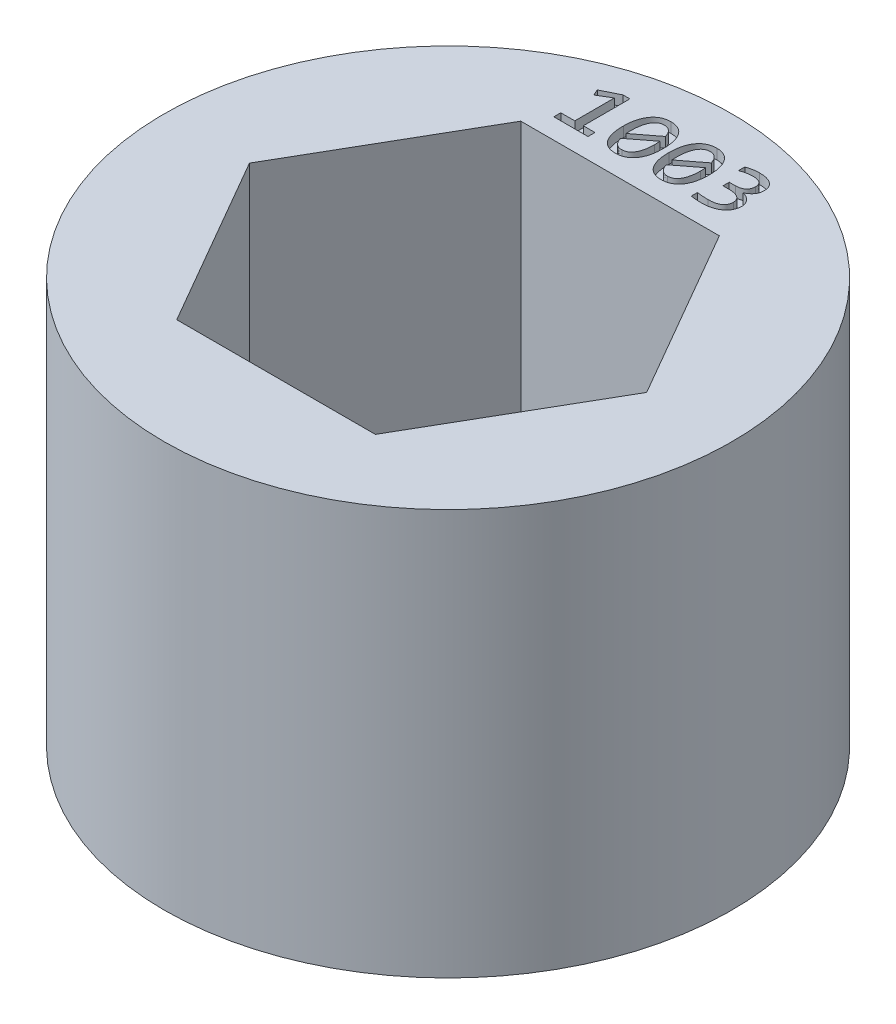
from build123d import *

# Parameters (mm, degrees)
SKETCH1_R           = 11.1125
BOSS_EXTRUDE1_DEPTH = 15.875
CUT_EXTRUDE1_DEPTH  = 0.4


with BuildPart() as part:
    # Sketch1 → Boss-Extrude1 (new body)
    with BuildSketch(Plane(origin=(0, 0, 0), x_dir=(1, 0, 0), z_dir=(0, 1, 0))):
        with Locations(Location((0, 0, 0), (0, 0, 270))):
            Circle(SKETCH1_R)
        Polygon((7.772289324, 0), (3.886144662, 6.731), (-3.886144662, 6.731), (-7.772289324, 0), (-3.886144662, -6.731), (3.886144662, -6.731), align=None, mode=Mode.SUBTRACT)
    extrude(amount=BOSS_EXTRUDE1_DEPTH)

    # Sketch2 → Cut-Extrude1 (cut)
    # profile 1 of 4: a face of its own
    with BuildSketch(Plane(origin=(0, 15.875, 0), x_dir=(1, 0, 0), z_dir=(0, 1, 0))):
        Polygon((-2.049251493, 7.52475), (-3.385828712, 7.52475), (-3.385828712, 7.798140795), (-2.839047122, 7.798140795), (-2.839047122, 9.347355299), (-3.343586037, 9.043587749), (-3.446582222, 9.286601789), (-2.776395065, 9.620746094), (-2.504902817, 9.620746094), (-2.504902817, 7.798140795), (-2.049251493, 7.798140795), align=None)
    # profile 2 of 4: a face of its own
    with BuildSketch(Plane(origin=(0, 15.875, 0), x_dir=(1, 0, 0), z_dir=(0, 1, 0))):
        with BuildLine():
            add(Edge.make_bspline(
                [(-0.165892684, 8.571798773), (-0.166325651, 8.532539667), (-0.167173732, 8.455640449), (-0.177140738, 8.343154692), (-0.192029215, 8.235790499), (-0.213292587, 8.133952321), (-0.240272581, 8.037990717), (-0.274910407, 7.94907057), (-0.314865217, 7.866804514), (-0.36154288, 7.791798506), (-0.414321619, 7.724560589), (-0.47324158, 7.664946723), (-0.538399911, 7.613533187), (-0.609814661, 7.570502981), (-0.68721939, 7.535730504), (-0.771505487, 7.511991642), (-0.861946132, 7.496719325), (-0.924455141, 7.495170599), (-0.956637587, 7.494373245)],
                knots=[0, 0, 0, 0, 1.248871528, 2.446241243, 3.590357027, 4.69618527, 5.754202854, 6.758290001, 7.728669934, 8.660396172, 9.563796911, 10.443071522, 11.321307858, 12.197637495, 13.090115231, 14.012601613, 14.976798049, 16, 16, 16, 16], degree=3))
            add(Edge.make_bspline(
                [(-0.956637587, 7.494373245), (-0.984523883, 7.495052085), (-1.039450838, 7.49638918), (-1.119857224, 7.508449964), (-1.196306294, 7.528578979), (-1.268936867, 7.555832092), (-1.33687734, 7.592268051), (-1.399769911, 7.637185139), (-1.457884215, 7.690364794), (-1.510227055, 7.752740329), (-1.557317942, 7.823677829), (-1.598168065, 7.90395186), (-1.633485499, 7.992818781), (-1.663637227, 8.090645609), (-1.686393921, 8.197912899), (-1.703489664, 8.314242635), (-1.713327632, 8.43999634), (-1.714500293, 8.526849228), (-1.715107188, 8.571798773)],
                knots=[0, 0, 0, 0, 0.897102697, 1.767001224, 2.609309556, 3.43771295, 4.257811968, 5.082953918, 5.919052252, 6.786174452, 7.6970727, 8.653553743, 9.679470751, 10.771494031, 11.944028827, 13.204944144, 14.553456404, 16, 16, 16, 16], degree=3))
            add(Edge.make_bspline(
                [(-1.715107188, 8.571798773), (-1.71439973, 8.61105018), (-1.713011452, 8.688075074), (-1.704182638, 8.80098373), (-1.688450082, 8.908608048), (-1.666850285, 9.010640269), (-1.638993202, 9.106716551), (-1.604965465, 9.195993499), (-1.56504748, 9.278286577), (-1.518887126, 9.353393458), (-1.466343023, 9.420893929), (-1.407260963, 9.480522767), (-1.342058547, 9.532107187), (-1.270210211, 9.574984835), (-1.192479257, 9.609682096), (-1.108222811, 9.633455575), (-1.01826503, 9.648757906), (-0.956228477, 9.650320298), (-0.924362285, 9.651122849)],
                knots=[0, 0, 0, 0, 1.248165713, 2.449334701, 3.598380242, 4.704508407, 5.763215836, 6.776019403, 7.739017366, 8.667464557, 9.574217704, 10.452902578, 11.330549874, 12.210601904, 13.107080692, 14.028948355, 14.987533857, 16, 16, 16, 16], degree=3))
            add(Edge.make_bspline(
                [(-0.924362285, 9.651122849), (-0.896475332, 9.65044401), (-0.841547085, 9.649106917), (-0.761301786, 9.637068879), (-0.684906628, 9.616988523), (-0.612566496, 9.588928446), (-0.544255062, 9.55306767), (-0.481529832, 9.507650243), (-0.423570481, 9.4541749), (-0.371366128, 9.391384812), (-0.324102603, 9.320190323), (-0.282877316, 9.240086592), (-0.247896786, 9.150892646), (-0.21811261, 9.053170973), (-0.194357973, 8.94609034), (-0.177578445, 8.829814678), (-0.16764054, 8.703922163), (-0.166489433, 8.616908067), (-0.165892684, 8.571798773)],
                knots=[0, 0, 0, 0, 0.896490568, 1.765795528, 2.602608418, 3.432274242, 4.256303472, 5.076742829, 5.915718828, 6.786140009, 7.696416714, 8.659101079, 9.677705081, 10.773848187, 11.941709476, 13.20176442, 14.549356535, 16, 16, 16, 16], degree=3))
        make_face()
        with BuildLine():
            add(Edge.make_bspline(
                [(-0.469660234, 8.555661122), (-0.469767537, 8.573863715), (-0.469981394, 8.610141868), (-0.474024404, 8.66420242), (-0.477403908, 8.717562964), (-0.480799232, 8.752800822), (-0.482475427, 8.770196954)],
                knots=[0, 0, 0, 0, 1.015676625, 2.024265076, 3.024624451, 4, 4, 4, 4], degree=3))
            Line((-0.482475427, 8.770196954), (-1.352010038, 8.101908345))
            add(Edge.make_bspline(
                [(-1.352010038, 8.101908345), (-1.34345071, 8.076265996), (-1.326662373, 8.025970882), (-1.294265101, 7.955066462), (-1.254555089, 7.89173888), (-1.206818183, 7.837824622), (-1.151314915, 7.794527876), (-1.099629529, 7.766900506), (-1.054544191, 7.751966897), (-1.018409114, 7.743163446), (-0.979846281, 7.738703342), (-0.953482359, 7.737832032), (-0.940025299, 7.737387285)],
                knots=[0, 0, 0, 0, 1.361870802, 2.671184605, 3.91877896, 5.116024374, 6.280451232, 7.450298556, 8.047911377, 8.670688444, 9.321473259, 10, 10, 10, 10], degree=3))
            add(Edge.make_bspline(
                [(-0.940025299, 7.737387285), (-0.922568023, 7.737990031), (-0.888151282, 7.739178334), (-0.837940335, 7.749690283), (-0.790019018, 7.765595868), (-0.744956902, 7.788922519), (-0.702437868, 7.81819234), (-0.664088949, 7.855043255), (-0.627980083, 7.897005683), (-0.595887758, 7.945833557), (-0.56696193, 8.000716962), (-0.54122657, 8.061797586), (-0.519690508, 8.129212654), (-0.501773845, 8.20284563), (-0.487029219, 8.282354818), (-0.476801204, 8.368116723), (-0.470554024, 8.459848262), (-0.469964364, 8.523058842), (-0.469660234, 8.555661122)],
                knots=[0, 0, 0, 0, 0.796240393, 1.569775284, 2.332781704, 3.095240773, 3.878796528, 4.681173991, 5.516437293, 6.40201063, 7.34239963, 8.345981007, 9.424260963, 10.57011489, 11.804224653, 13.114209461, 14.5115885, 16, 16, 16, 16], degree=3))
        make_face(mode=Mode.SUBTRACT)
        with BuildLine():
            add(Edge.make_bspline(
                [(-1.411339638, 8.575121231), (-1.411359377, 8.558192429), (-1.411398856, 8.524334087), (-1.411104532, 8.473852915), (-1.409430028, 8.424119907), (-1.406576912, 8.391427549), (-1.40516936, 8.375299139)],
                knots=[0, 0, 0, 0, 1.015676347, 2.03139705, 3.028811753, 4, 4, 4, 4], degree=3))
            Line((-1.40516936, 8.375299139), (-0.535160112, 9.043587749))
            add(Edge.make_bspline(
                [(-0.535160112, 9.043587749), (-0.543388282, 9.06962101), (-0.55938939, 9.120247212), (-0.593277284, 9.190237885), (-0.631981209, 9.253403948), (-0.679714875, 9.306455436), (-0.733736714, 9.350825781), (-0.785361246, 9.377733147), (-0.829524865, 9.3935938), (-0.864965959, 9.402303753), (-0.902414282, 9.406781166), (-0.927991087, 9.407661784), (-0.940974573, 9.408108809)],
                knots=[0, 0, 0, 0, 1.387569518, 2.698370158, 3.946895934, 5.144331536, 6.312393877, 7.486406228, 8.084826247, 8.697958228, 9.339048001, 10, 10, 10, 10], degree=3))
            add(Edge.make_bspline(
                [(-0.940974573, 9.408108809), (-0.958425679, 9.407488034), (-0.992830258, 9.406264186), (-1.04303389, 9.396031422), (-1.090739, 9.379139534), (-1.13598574, 9.355773608), (-1.178581811, 9.325843448), (-1.217031274, 9.288351162), (-1.253677288, 9.245695765), (-1.285520627, 9.19530522), (-1.314500544, 9.139278924), (-1.339775267, 9.076800562), (-1.361156549, 9.008131554), (-1.379940417, 8.933425934), (-1.393792523, 8.852471795), (-1.404251708, 8.765520689), (-1.410428728, 8.672353508), (-1.411029772, 8.60819695), (-1.411339638, 8.575121231)],
                knots=[0, 0, 0, 0, 0.786453526, 1.550480632, 2.299704824, 3.062398082, 3.840423392, 4.637837687, 5.478332318, 6.370910143, 7.318703432, 8.320397478, 9.40580758, 10.560070273, 11.791787257, 13.106920475, 14.508481623, 16, 16, 16, 16], degree=3))
        make_face(mode=Mode.SUBTRACT)
    # profile 3 of 4: a face of its own
    with BuildSketch(Plane(origin=(0, 15.875, 0), x_dir=(1, 0, 0), z_dir=(0, 1, 0))):
        with BuildLine():
            add(Edge.make_bspline(
                [(1.62633586, 8.571798773), (1.625902893, 8.532539667), (1.625054812, 8.455640449), (1.615087806, 8.343154692), (1.600199328, 8.235790499), (1.578935957, 8.133952321), (1.551955963, 8.037990717), (1.517318137, 7.94907057), (1.477363327, 7.866804514), (1.430685663, 7.791798506), (1.377906925, 7.724560589), (1.318986964, 7.664946723), (1.253828633, 7.613533187), (1.182413883, 7.570502981), (1.105009154, 7.535730504), (1.020723057, 7.511991642), (0.930282412, 7.496719325), (0.867773403, 7.495170599), (0.835590957, 7.494373245)],
                knots=[0, 0, 0, 0, 1.248871528, 2.446241243, 3.590357027, 4.69618527, 5.754202854, 6.758290001, 7.728669934, 8.660396172, 9.563796911, 10.443071522, 11.321307858, 12.197637495, 13.090115231, 14.012601613, 14.976798049, 16, 16, 16, 16], degree=3))
            add(Edge.make_bspline(
                [(0.835590957, 7.494373245), (0.807704661, 7.495052085), (0.752777706, 7.49638918), (0.67237132, 7.508449964), (0.59592225, 7.528578979), (0.523291677, 7.555832092), (0.455351204, 7.592268051), (0.392458633, 7.637185139), (0.334344328, 7.690364794), (0.282001489, 7.752740329), (0.234910602, 7.823677829), (0.194060479, 7.90395186), (0.158743045, 7.992818781), (0.128591317, 8.090645609), (0.105834623, 8.197912899), (0.08873888, 8.314242635), (0.078900912, 8.43999634), (0.077728251, 8.526849228), (0.077121356, 8.571798773)],
                knots=[0, 0, 0, 0, 0.897102697, 1.767001224, 2.609309556, 3.43771295, 4.257811968, 5.082953918, 5.919052252, 6.786174452, 7.6970727, 8.653553743, 9.679470751, 10.771494031, 11.944028827, 13.204944144, 14.553456404, 16, 16, 16, 16], degree=3))
            add(Edge.make_bspline(
                [(0.077121356, 8.571798773), (0.077828814, 8.61105018), (0.079217092, 8.688075074), (0.088045906, 8.80098373), (0.103778462, 8.908608048), (0.125378259, 9.010640269), (0.153235342, 9.106716551), (0.187263079, 9.195993499), (0.227181064, 9.278286577), (0.273341418, 9.353393458), (0.325885521, 9.420893929), (0.384967581, 9.480522767), (0.450169997, 9.532107187), (0.522018333, 9.574984835), (0.599749287, 9.609682096), (0.684005733, 9.633455575), (0.773963514, 9.648757906), (0.836000067, 9.650320298), (0.867866259, 9.651122849)],
                knots=[0, 0, 0, 0, 1.248165713, 2.449334701, 3.598380242, 4.704508407, 5.763215836, 6.776019403, 7.739017366, 8.667464557, 9.574217704, 10.452902578, 11.330549874, 12.210601904, 13.107080692, 14.028948355, 14.987533857, 16, 16, 16, 16], degree=3))
            add(Edge.make_bspline(
                [(0.867866259, 9.651122849), (0.895753212, 9.65044401), (0.950681459, 9.649106917), (1.030926758, 9.637068879), (1.107321916, 9.616988523), (1.179662048, 9.588928446), (1.247973482, 9.55306767), (1.310698712, 9.507650243), (1.368658063, 9.4541749), (1.420862416, 9.391384812), (1.468125941, 9.320190323), (1.509351228, 9.240086592), (1.544331758, 9.150892646), (1.574115934, 9.053170973), (1.597870571, 8.94609034), (1.614650099, 8.829814678), (1.624588004, 8.703922163), (1.625739111, 8.616908067), (1.62633586, 8.571798773)],
                knots=[0, 0, 0, 0, 0.896490568, 1.765795528, 2.602608418, 3.432274242, 4.256303472, 5.076742829, 5.915718828, 6.786140009, 7.696416714, 8.659101079, 9.677705081, 10.773848187, 11.941709476, 13.20176442, 14.549356535, 16, 16, 16, 16], degree=3))
        make_face()
        with BuildLine():
            add(Edge.make_bspline(
                [(1.32256831, 8.555661122), (1.322461007, 8.573863715), (1.322247149, 8.610141868), (1.31820414, 8.66420242), (1.314824636, 8.717562964), (1.311429311, 8.752800822), (1.309753117, 8.770196954)],
                knots=[0, 0, 0, 0, 1.015676625, 2.024265076, 3.024624451, 4, 4, 4, 4], degree=3))
            Line((1.309753117, 8.770196954), (0.440218505, 8.101908345))
            add(Edge.make_bspline(
                [(0.440218505, 8.101908345), (0.448777834, 8.076265996), (0.465566171, 8.025970882), (0.497963443, 7.955066462), (0.537673455, 7.89173888), (0.585410361, 7.837824622), (0.640913629, 7.794527876), (0.692599015, 7.766900506), (0.737684353, 7.751966897), (0.77381943, 7.743163446), (0.812382263, 7.738703342), (0.838746185, 7.737832032), (0.852203245, 7.737387285)],
                knots=[0, 0, 0, 0, 1.361870802, 2.671184605, 3.91877896, 5.116024374, 6.280451232, 7.450298556, 8.047911377, 8.670688444, 9.321473259, 10, 10, 10, 10], degree=3))
            add(Edge.make_bspline(
                [(0.852203245, 7.737387285), (0.86966052, 7.737990031), (0.904077262, 7.739178334), (0.954288209, 7.749690283), (1.002209526, 7.765595868), (1.047271642, 7.788922519), (1.089790676, 7.81819234), (1.128139595, 7.855043255), (1.164248461, 7.897005683), (1.196340786, 7.945833557), (1.225266614, 8.000716962), (1.251001974, 8.061797586), (1.272538036, 8.129212654), (1.290454699, 8.20284563), (1.305199325, 8.282354818), (1.31542734, 8.368116723), (1.32167452, 8.459848262), (1.32226418, 8.523058842), (1.32256831, 8.555661122)],
                knots=[0, 0, 0, 0, 0.796240393, 1.569775284, 2.332781704, 3.095240773, 3.878796528, 4.681173991, 5.516437293, 6.40201063, 7.34239963, 8.345981007, 9.424260963, 10.57011489, 11.804224653, 13.114209461, 14.5115885, 16, 16, 16, 16], degree=3))
        make_face(mode=Mode.SUBTRACT)
        with BuildLine():
            add(Edge.make_bspline(
                [(0.380888906, 8.575121231), (0.380869167, 8.558192429), (0.380829688, 8.524334087), (0.381124012, 8.473852915), (0.382798516, 8.424119907), (0.385651632, 8.391427549), (0.387059184, 8.375299139)],
                knots=[0, 0, 0, 0, 1.015676347, 2.03139705, 3.028811753, 4, 4, 4, 4], degree=3))
            Line((0.387059184, 8.375299139), (1.257068432, 9.043587749))
            add(Edge.make_bspline(
                [(1.257068432, 9.043587749), (1.248840262, 9.06962101), (1.232839154, 9.120247212), (1.19895126, 9.190237885), (1.160247335, 9.253403948), (1.112513669, 9.306455436), (1.05849183, 9.350825781), (1.006867298, 9.377733147), (0.962703679, 9.3935938), (0.927262585, 9.402303753), (0.889814262, 9.406781166), (0.864237457, 9.407661784), (0.851253971, 9.408108809)],
                knots=[0, 0, 0, 0, 1.387569518, 2.698370158, 3.946895934, 5.144331536, 6.312393877, 7.486406228, 8.084826247, 8.697958228, 9.339048001, 10, 10, 10, 10], degree=3))
            add(Edge.make_bspline(
                [(0.851253971, 9.408108809), (0.833802865, 9.407488034), (0.799398286, 9.406264186), (0.749194653, 9.396031422), (0.701489544, 9.379139534), (0.656242804, 9.355773608), (0.613646733, 9.325843448), (0.57519727, 9.288351162), (0.538551256, 9.245695765), (0.506707917, 9.19530522), (0.477728, 9.139278924), (0.452453277, 9.076800562), (0.431071995, 9.008131554), (0.412288127, 8.933425934), (0.398436021, 8.852471795), (0.387976836, 8.765520689), (0.381799816, 8.672353508), (0.381198772, 8.60819695), (0.380888906, 8.575121231)],
                knots=[0, 0, 0, 0, 0.786453526, 1.550480632, 2.299704824, 3.062398082, 3.840423392, 4.637837687, 5.478332318, 6.370910143, 7.318703432, 8.320397478, 9.40580758, 10.560070273, 11.791787257, 13.106920475, 14.508481623, 16, 16, 16, 16], degree=3))
        make_face(mode=Mode.SUBTRACT)
    # profile 4 of 4: a face of its own
    with BuildSketch(Plane(origin=(0, 15.875, 0), x_dir=(1, 0, 0), z_dir=(0, 1, 0))):
        with BuildLine():
            add(Edge.make_bspline(
                [(3.327434139, 8.169781407), (3.3266273, 8.14680646), (3.325027591, 8.101254385), (3.314578034, 8.033962565), (3.296200868, 7.968964292), (3.271264949, 7.906223376), (3.238564226, 7.846735455), (3.199771329, 7.790150789), (3.15255563, 7.738366782), (3.098892601, 7.690132978), (3.037472873, 7.647006481), (2.969383482, 7.607740538), (2.893317942, 7.574307596), (2.810219328, 7.54539114), (2.719985393, 7.521964131), (2.622401073, 7.506357669), (2.517923954, 7.496081915), (2.445743537, 7.494954424), (2.408537301, 7.494373245)],
                knots=[0, 0, 0, 0, 0.861844565, 1.708766071, 2.546803722, 3.390976017, 4.235482026, 5.088267806, 5.958166408, 6.857625573, 7.789680516, 8.767975323, 9.801402493, 10.901266619, 12.065759824, 13.293144602, 14.604719897, 16, 16, 16, 16], degree=3))
            add(Edge.make_bspline(
                [(2.408537301, 7.494373245), (2.368343602, 7.49485662), (2.292176875, 7.495772612), (2.183369427, 7.501822994), (2.084359278, 7.512189393), (2.021373356, 7.520650585), (1.99085692, 7.52475)],
                knots=[0, 0, 0, 0, 1.150713897, 2.180593327, 3.118504498, 4, 4, 4, 4], degree=3))
            Line((1.99085692, 7.52475), (1.99085692, 7.76776404))
            add(Edge.make_bspline(
                [(1.99085692, 7.76776404), (2.025322508, 7.76328296), (2.095869005, 7.754110782), (2.2044373, 7.744088717), (2.317030587, 7.738510765), (2.393343053, 7.737763705), (2.431794504, 7.737387285)],
                knots=[0, 0, 0, 0, 0.942811003, 1.929809335, 2.956896058, 4, 4, 4, 4], degree=3))
            add(Edge.make_bspline(
                [(2.431794504, 7.737387285), (2.457274025, 7.737780482), (2.506548631, 7.738540882), (2.577429874, 7.743510918), (2.642566653, 7.752607886), (2.702071612, 7.764815785), (2.756303709, 7.780247306), (2.805224242, 7.799382092), (2.848939032, 7.821428611), (2.887366958, 7.846906866), (2.921086871, 7.875002132), (2.949576983, 7.906376076), (2.973230945, 7.940523764), (2.991834164, 7.97750506), (3.005911818, 8.017128597), (3.016506593, 8.059205264), (3.022702131, 8.103779337), (3.023341583, 8.134322749), (3.023666589, 8.149846661)],
                knots=[0, 0, 0, 0, 1.490140128, 2.881768065, 4.152352525, 5.333691038, 6.431800578, 7.445549096, 8.401444764, 9.289364022, 10.136425943, 10.961731228, 11.759931868, 12.558561418, 13.375159002, 14.214453508, 15.092482988, 16, 16, 16, 16], degree=3))
            add(Edge.make_bspline(
                [(3.023666589, 8.149846661), (3.023225067, 8.163954823), (3.022365776, 8.191412119), (3.015271449, 8.231277086), (3.002688276, 8.268019622), (2.98607476, 8.302110265), (2.964775925, 8.333101506), (2.940077922, 8.361933297), (2.910833386, 8.387535636), (2.877760232, 8.410419657), (2.84117954, 8.43050568), (2.801632521, 8.449047379), (2.758131161, 8.463263911), (2.711756918, 8.475781649), (2.662504167, 8.484860736), (2.610934992, 8.492383788), (2.556987671, 8.495831651), (2.520238108, 8.496477839), (2.501566113, 8.496806159)],
                knots=[0, 0, 0, 0, 0.962645216, 1.873499504, 2.751163712, 3.60600831, 4.45366029, 5.311093063, 6.190880762, 7.098592726, 8.05100711, 9.036815858, 10.075001357, 11.16993685, 12.313633837, 13.491143935, 14.725281481, 16, 16, 16, 16], degree=3))
            Line((2.501566113, 8.496806159), (2.264247715, 8.496806159))
            Line((2.264247715, 8.496806159), (2.264247715, 8.739820199))
            Line((2.264247715, 8.739820199), (2.508685665, 8.739820199))
            add(Edge.make_bspline(
                [(2.508685665, 8.739820199), (2.52420407, 8.740041039), (2.554684458, 8.740474799), (2.599245962, 8.745428854), (2.641764156, 8.752968685), (2.682100596, 8.763353189), (2.720122909, 8.77652879), (2.755217393, 8.792641221), (2.787534696, 8.811344416), (2.816846741, 8.832763338), (2.843822746, 8.856258405), (2.866516564, 8.883371538), (2.88684463, 8.912372698), (2.903259561, 8.944390353), (2.916917384, 8.978594292), (2.925524167, 9.015574869), (2.931542875, 9.054465629), (2.932200995, 9.081217643), (2.932536324, 9.094848523)],
                knots=[0, 0, 0, 0, 1.192823995, 2.342878639, 3.443008352, 4.511191983, 5.54236148, 6.533123054, 7.476280357, 8.408308338, 9.321648148, 10.218966078, 11.119987697, 12.039625921, 12.979481888, 13.944359475, 14.9525951, 16, 16, 16, 16], degree=3))
            add(Edge.make_bspline(
                [(2.932536324, 9.094848523), (2.932365424, 9.108001647), (2.932032436, 9.133629703), (2.926529234, 9.170464269), (2.918596582, 9.20472506), (2.907243789, 9.236177804), (2.892467427, 9.264942111), (2.874271689, 9.290827082), (2.852722072, 9.313866691), (2.827705964, 9.333747997), (2.799924003, 9.351513029), (2.768852866, 9.366728991), (2.734664786, 9.379139117), (2.697753846, 9.390562934), (2.657605838, 9.398176428), (2.614491072, 9.403771302), (2.568409362, 9.407880066), (2.536540703, 9.408030891), (2.520076948, 9.408108809)],
                knots=[0, 0, 0, 0, 1.064287749, 2.073699511, 3.009236736, 3.9091673, 4.774588449, 5.620725501, 6.46384913, 7.320401755, 8.201989857, 9.130391188, 10.115765889, 11.145550715, 12.256343534, 13.419843727, 14.667058473, 16, 16, 16, 16], degree=3))
            add(Edge.make_bspline(
                [(2.520076948, 9.408108809), (2.483468349, 9.406968205), (2.408607625, 9.40463579), (2.314794724, 9.389642815), (2.237714288, 9.372702095), (2.177408518, 9.356960609), (2.115045949, 9.338409225), (2.073083855, 9.324232999), (2.05161043, 9.316978544)],
                knots=[0, 0, 0, 0, 1.374009053, 2.809703548, 3.557729416, 4.33717134, 5.149074242, 6, 6, 6, 6], degree=3))
            Line((2.05161043, 9.316978544), (2.05161043, 9.559992584))
            add(Edge.make_bspline(
                [(2.05161043, 9.559992584), (2.070838703, 9.567017653), (2.110056969, 9.581346087), (2.171040672, 9.598908022), (2.23355317, 9.614559478), (2.29679761, 9.627210242), (2.359763609, 9.6378266), (2.422172101, 9.645252998), (2.483128248, 9.650371729), (2.523231335, 9.650876025), (2.542859514, 9.651122849)],
                knots=[0, 0, 0, 0, 0.978322217, 1.995400233, 3.031781794, 4.058180853, 5.077730371, 6.083355555, 7.06191161, 8, 8, 8, 8], degree=3))
            add(Edge.make_bspline(
                [(2.542859514, 9.651122849), (2.570561883, 9.65067075), (2.624151463, 9.649796177), (2.701974012, 9.642978196), (2.774690983, 9.632421211), (2.842313127, 9.616792871), (2.904536896, 9.596693558), (2.962005179, 9.573729509), (3.013866489, 9.546180444), (3.060369488, 9.514690754), (3.101358384, 9.479395403), (3.137396305, 9.440702448), (3.167925157, 9.398322437), (3.192739144, 9.352289125), (3.212126493, 9.303180321), (3.226695218, 9.251083539), (3.234574929, 9.195712938), (3.235719735, 9.157839901), (3.236303874, 9.138515108)],
                knots=[0, 0, 0, 0, 1.364346343, 2.639295939, 3.84503498, 4.981142705, 6.053223054, 7.063352329, 8.025569508, 8.939887992, 9.824051135, 10.684331437, 11.538625567, 12.389464824, 13.253408307, 14.134440564, 15.048094572, 16, 16, 16, 16], degree=3))
            add(Edge.make_bspline(
                [(3.236303874, 9.138515108), (3.235338611, 9.110092289), (3.233468776, 9.055033723), (3.215312426, 8.975958604), (3.186057674, 8.903698561), (3.14368389, 8.839489746), (3.09183264, 8.782262237), (3.031243887, 8.731328881), (2.962642998, 8.685435129), (2.911700998, 8.661782508), (2.885547281, 8.649639208)],
                knots=[0, 0, 0, 0, 1.062433809, 2.058067584, 3.019272504, 3.965418163, 4.921501302, 5.900439357, 6.922081703, 8, 8, 8, 8], degree=3))
            add(Edge.make_bspline(
                [(2.885547281, 8.649639208), (2.912712024, 8.64405295), (2.9678019, 8.632724065), (3.046417318, 8.598652946), (3.121244406, 8.554997709), (3.176999265, 8.508067016), (3.216991764, 8.465880902), (3.243913448, 8.431071468), (3.268550262, 8.393890097), (3.289213593, 8.353571589), (3.306459033, 8.31094626), (3.318950775, 8.265932354), (3.326109013, 8.218584703), (3.326986715, 8.186259671), (3.327434139, 8.169781407)],
                knots=[0, 0, 0, 0, 1.405413986, 2.85016813, 4.327699737, 5.794019892, 6.533135325, 7.277475483, 8.026443619, 8.795662385, 9.574684764, 10.358501172, 11.163216512, 12, 12, 12, 12], degree=3))
        make_face()
    extrude(amount=-CUT_EXTRUDE1_DEPTH, mode=Mode.SUBTRACT)


solid = part.part
